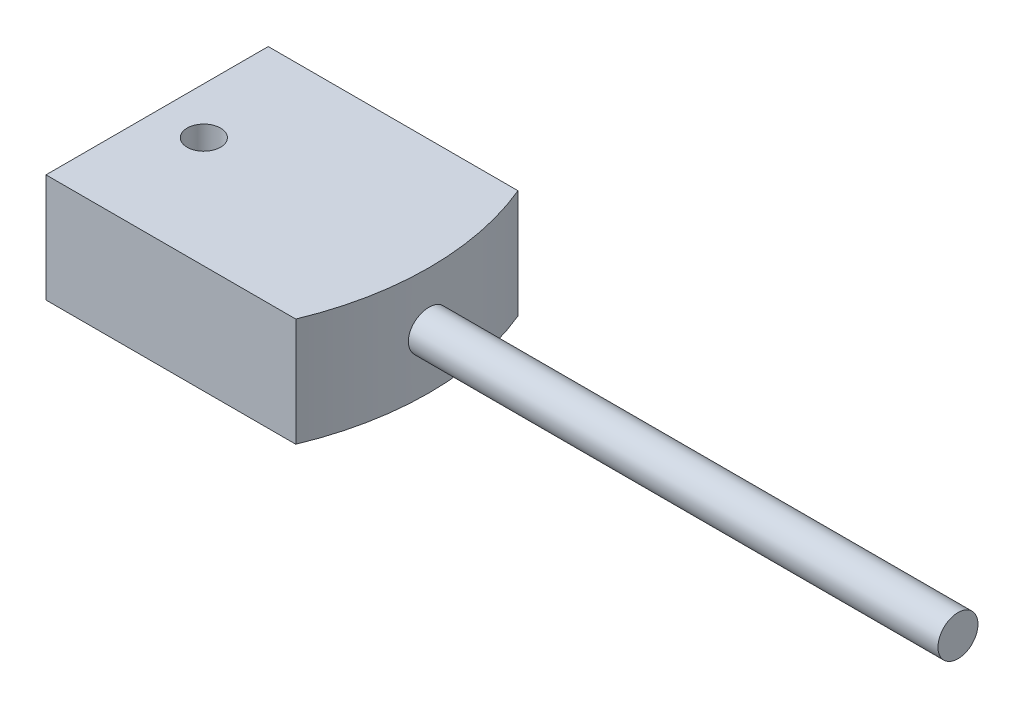
from build123d import *

# Parameters (mm, degrees)
BOSS_EXTRUDE1_DEPTH      = 4.1275
BOSS_EXTRUDE1_DEPTH_BACK = 4.1275
SKETCH1_R                = 1.27


with BuildPart() as part:
    # Sketch1 → Boss-Extrude1 (new, two sides: drawn at the far end of the back side and taken through both)
    with BuildSketch(Plane(origin=(0, 0, 0), x_dir=(1, 0, 0), z_dir=(0, 1, 0)).offset(-BOSS_EXTRUDE1_DEPTH_BACK)):
        with BuildLine():
            Line((0, 8.4582), (19.010911587, 8.4582))
            ThreePointArc((19.010911587, 8.4582), (20.701, 0), (19.010911587, -8.4582))
            Line((19.010911587, -8.4582), (0, -8.4582))
            Line((0, -8.4582), (0, 8.4582))
        make_face()
        with Locations((3.556, 0)):
            Circle(SKETCH1_R, mode=Mode.SUBTRACT)
    extrude(amount=BOSS_EXTRUDE1_DEPTH + BOSS_EXTRUDE1_DEPTH_BACK)

    # Sketch2 → Revolve1 (revolve)
    with BuildSketch(Plane(origin=(0, 0, 0), x_dir=(1, 0, 0), z_dir=(0, 1, 0))):
        Polygon((20.701, 0), (60.96, 0), (60.96, 1.524), (20.701, 1.524), (20.016943544, 1.524), (20.016943544, 0), align=None)
    revolve(axis=Axis((21.73605, 0, 0), (-1, 0, 0)))


solid = part.part
